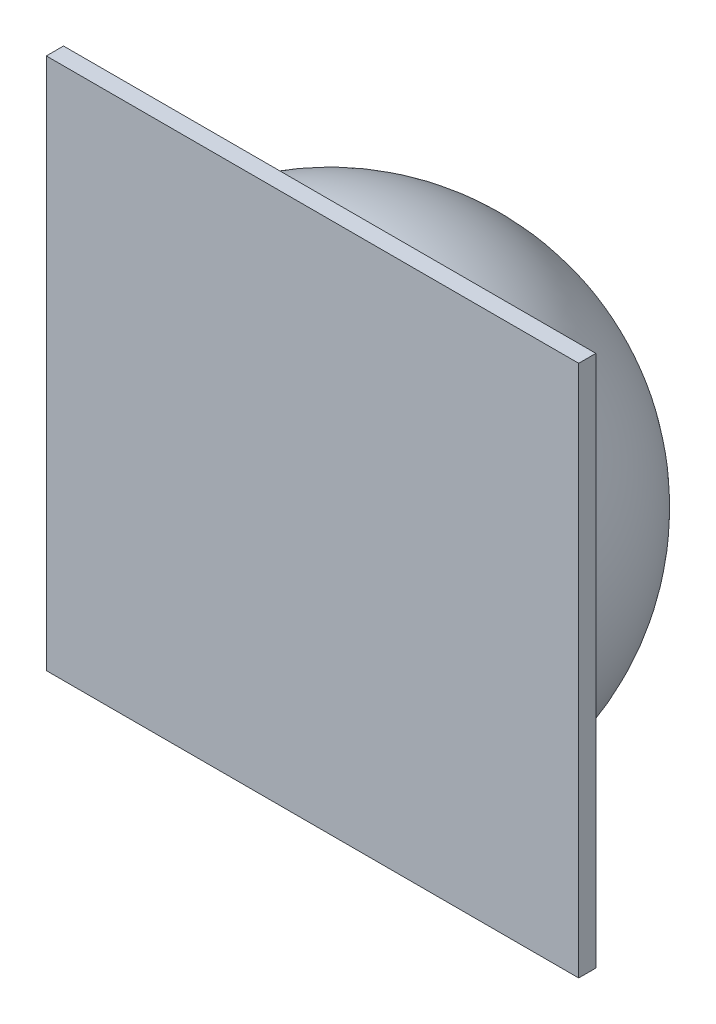
from build123d import *

# Parameters (mm, degrees)
SHELL1_T            = -2
SKETCH3_W           = 31
SKETCH3_H           = 31
BOSS_EXTRUDE1_DEPTH = 1


with BuildPart() as part:
    # Sketch1 → Revolve1 (revolve)
    with BuildSketch(Plane(origin=(0, 0, 0), x_dir=(1, 0, 0), z_dir=(0, 1, 0))):
        with BuildLine():
            Line((0, 14), (0, 0))
            Line((0, 0), (14, 0))
            ThreePointArc((14, 0), (9.899494937, 9.899494937), (0, 14))
        make_face()
    revolve(axis=Axis((0, 0, -14), (0, 0, 1)))

    # Shell1
    shell1_openings = [part.faces().sort_by_distance(p)[0] for p in [
        (0, 0, 0),
    ]]
    offset(amount=SHELL1_T, openings=shell1_openings, kind=Kind.INTERSECTION)

    # Sketch3 → Boss-Extrude1 (add)
    with BuildSketch(Plane.XY):
        Rectangle(SKETCH3_W, SKETCH3_H)
    extrude(amount=BOSS_EXTRUDE1_DEPTH)


solid = part.part
